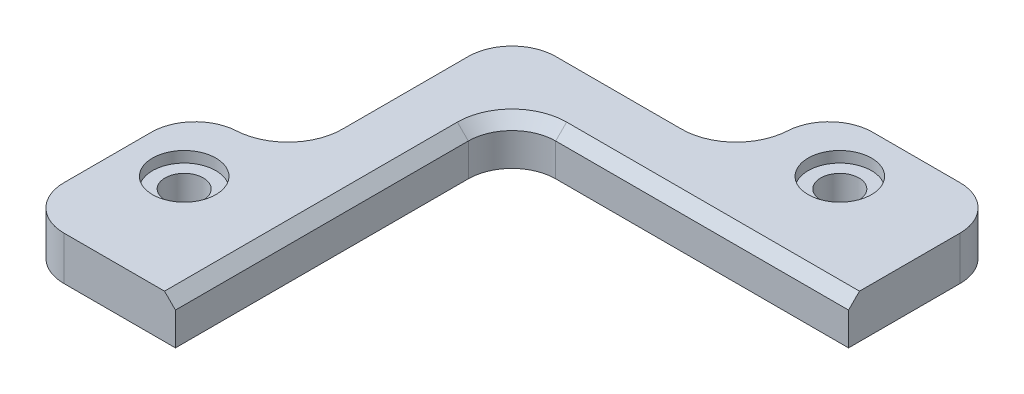
from build123d import *

# Parameters (mm, degrees)
CROQUIS1_R              = 1.75
SALIENTE_EXTRUIR1_DEPTH = 4
CROQUIS2_W              = 30.8
CROQUIS2_H              = 4.2
SALIENTE_EXTRUIR2_DEPTH = 4
CROQUIS3_W              = 8.5
CROQUIS3_H              = 20.5
CORTAR_EXTRUIR1_DEPTH   = 4
REDONDEO1_R             = 4
REDONDEO2_R             = 4
CHAFL_N1_SIZE           = 1
CROQUIS4_R              = 2.9
CORTAR_EXTRUIR2_DEPTH   = 1
REDONDEO3_R             = 5


with BuildPart() as part:
    # Croquis1 → Saliente-Extruir1 (new body)
    with BuildSketch(Plane(origin=(0, 0, 0), x_dir=(1, 0, 0), z_dir=(0, 1, 0))):
        Polygon((0, 0), (0, 45), (45, 45), (45, 35), (10, 35), (10, 0), align=None)
        with Locations(Location((35, 40, 0), (0, 0, 270))):
            Circle(CROQUIS1_R, mode=Mode.SUBTRACT)
        with Locations(Location((5, 10, 0), (0, 0, 270))):
            Circle(CROQUIS1_R, mode=Mode.SUBTRACT)
    extrude(amount=SALIENTE_EXTRUIR1_DEPTH)

    # Croquis2 → Saliente-Extruir2 (add)
    with BuildSketch(Plane(origin=(0, 4, 0), x_dir=(1, 0, 0), z_dir=(0, 1, 0))):
        with Locations((29.6, 32.9)):
            Rectangle(CROQUIS2_W, CROQUIS2_H)
        Polygon((10, 35), (10, 0), (14.2, 0), (14.2, 30.8), (14.2, 35), align=None)
    extrude(amount=-SALIENTE_EXTRUIR2_DEPTH)

    # Croquis3 → Cortar-Extruir1 (cut)
    with BuildSketch(Plane(origin=(0, 4, 0), x_dir=(1, 0, 0), z_dir=(0, 1, 0))):
        Polygon((29, 45), (0, 45), (0, 36.5), (8.5, 36.5), (29, 36.5), align=None)
        with Locations((4.25, 26.25)):
            Rectangle(CROQUIS3_W, CROQUIS3_H)
    extrude(amount=-CORTAR_EXTRUIR1_DEPTH, mode=Mode.SUBTRACT)

    # Redondeo1
    redondeo1_edges = [part.edges().sort_by_distance(p)[0] for p in [
        (14.2, 2, -30.8),
        (8.5, 2, -36.5),
    ]]
    fillet(redondeo1_edges, radius=REDONDEO1_R)

    # Redondeo2
    redondeo2_edges = [part.edges().sort_by_distance(p)[0] for p in [
        (0, 2, 0),
        (45, 2, -45),
        (0, 2, -16),
        (29, 2, -45),
    ]]
    fillet(redondeo2_edges, radius=REDONDEO2_R)

    # Chaflán1
    chafl_n1_edges = [part.edges().sort_by_distance(p)[0] for p in [
        (31.6, 4, -30.8),
        (14.2, 4, -13.4),
        (15.371572875, 4, -29.628427125),
    ]]
    chamfer(chafl_n1_edges, length=CHAFL_N1_SIZE)

    # Croquis4 → Cortar-Extruir2 (cut)
    with BuildSketch(Plane(origin=(0, 4, 0), x_dir=(1, 0, 0), z_dir=(0, 1, 0))):
        with Locations(Location((35, 40, 0), (0, 0, 270))):
            Circle(CROQUIS4_R)
        with Locations(Location((5, 10, 0), (0, 0, 270))):
            Circle(CROQUIS4_R)
    extrude(amount=-CORTAR_EXTRUIR2_DEPTH, mode=Mode.SUBTRACT)

    # Redondeo3
    redondeo3_edges = [part.edges().sort_by_distance(p)[0] for p in [
        (8.5, 2, -16),
        (29, 2, -36.5),
    ]]
    fillet(redondeo3_edges, radius=REDONDEO3_R)


solid = part.part
